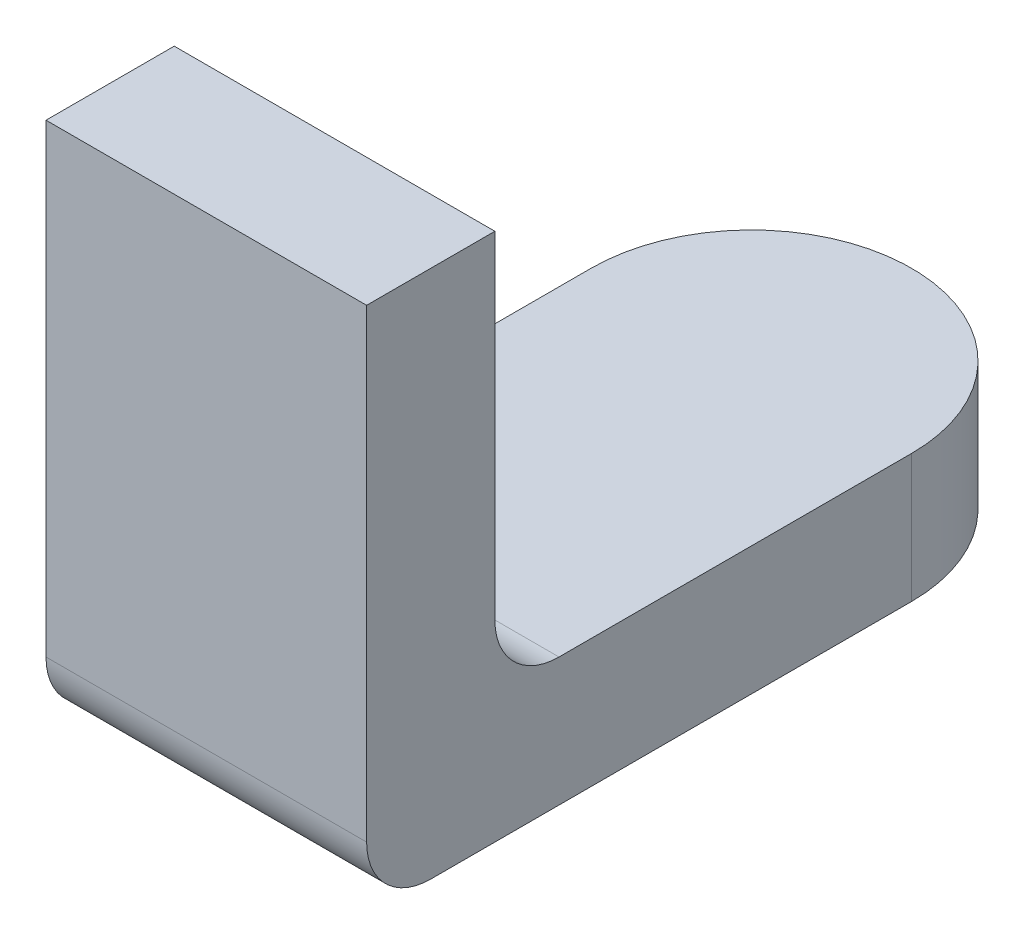
from build123d import *

# Parameters (mm, degrees)
RESSALTO_EXTRUS_O1_DEPTH = 8
ESBO_O2_W                = 20
ESBO_O2_H                = 8
RESSALTO_EXTRUS_O2_DEPTH = 25
FILETE1_R                = 4


with BuildPart() as part:
    # Esboço1 → Ressalto-extrusão1 (new body)
    with BuildSketch(Plane(origin=(0, 0, 0), x_dir=(1, 0, 0), z_dir=(0, 1, 0))):
        with BuildLine():
            Line((0, 0), (20, 0))
            Line((20, 0), (20, 34))
            ThreePointArc((20, 34), (10, 44), (0, 34))
            Line((0, 34), (0, 0))
        make_face()
    extrude(amount=RESSALTO_EXTRUS_O1_DEPTH)

    # Esboço2 → Ressalto-extrusão2 (add)
    with BuildSketch(Plane(origin=(0, 8, 0), x_dir=(1, 0, 0), z_dir=(0, 1, 0))):
        with Locations((10, 4)):
            Rectangle(ESBO_O2_W, ESBO_O2_H)
    extrude(amount=RESSALTO_EXTRUS_O2_DEPTH)

    # Filete1
    filete1_edges = [part.edges().sort_by_distance(p)[0] for p in [
        (10, 8, -8),
        (10, 0, 0),
    ]]
    fillet(filete1_edges, radius=FILETE1_R)


solid = part.part
